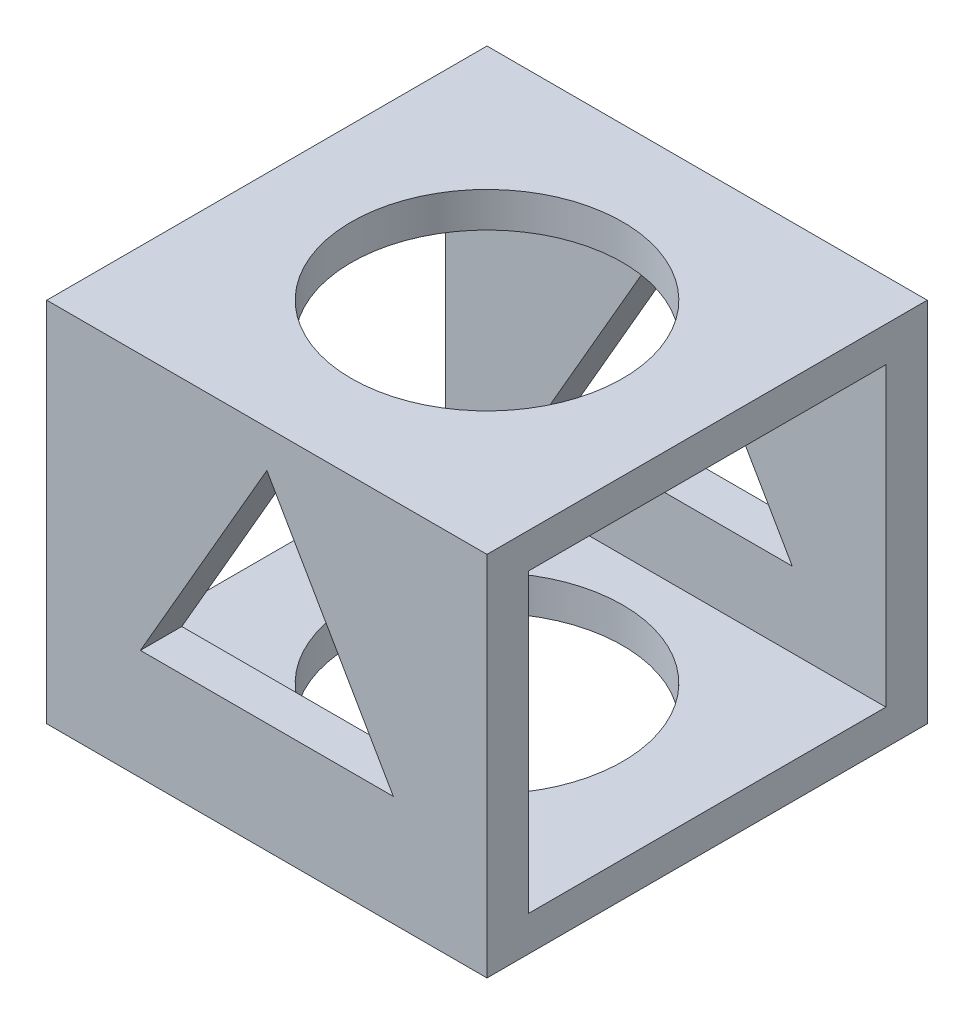
from build123d import *

# Parameters (mm, degrees)
SKETCH1_W           = 152.4
SKETCH1_H           = 127
BOSS_EXTRUDE1_DEPTH = 76.2
CUT_EXTRUDE1_DEPTH  = 182.836327504
SKETCH3_W           = 123.769027692
SKETCH3_H           = 102.663904472
CUT_EXTRUDE2_DEPTH  = 182.836327504
SKETCH4_R           = 46.960856135
CUT_EXTRUDE3_DEPTH  = 167.558938517


with BuildPart() as part:
    # Sketch1 → Boss-Extrude1 (new, symmetric)
    with BuildSketch(Plane.XY):
        Rectangle(SKETCH1_W, SKETCH1_H)
    extrude(amount=BOSS_EXTRUDE1_DEPTH, both=True)

    # Sketch2 → Cut-Extrude1 (cut, through all)
    with BuildSketch(Plane.XY.offset(76.2)):
        Polygon((0, 50.550598249), (-43.77810226, -25.275299124), (43.77810226, -25.275299124), align=None)
    extrude(amount=-CUT_EXTRUDE1_DEPTH, mode=Mode.SUBTRACT)

    # Sketch3 → Cut-Extrude2 (cut, through all)
    with BuildSketch(Plane(origin=(76.2, 0, 0), x_dir=(0, 0, -1), z_dir=(1, 0, 0))):
        Rectangle(SKETCH3_W, SKETCH3_H)
    extrude(amount=-CUT_EXTRUDE2_DEPTH, mode=Mode.SUBTRACT)

    # Sketch4 → Cut-Extrude3 (cut, through all)
    with BuildSketch(Plane(origin=(0, 63.5, 0), x_dir=(1, 0, 0), z_dir=(0, 1, 0))):
        with Locations(Location((0, 0, 0), (0, 0, 270))):
            Circle(SKETCH4_R)
    extrude(amount=-CUT_EXTRUDE3_DEPTH, mode=Mode.SUBTRACT)


solid = part.part
